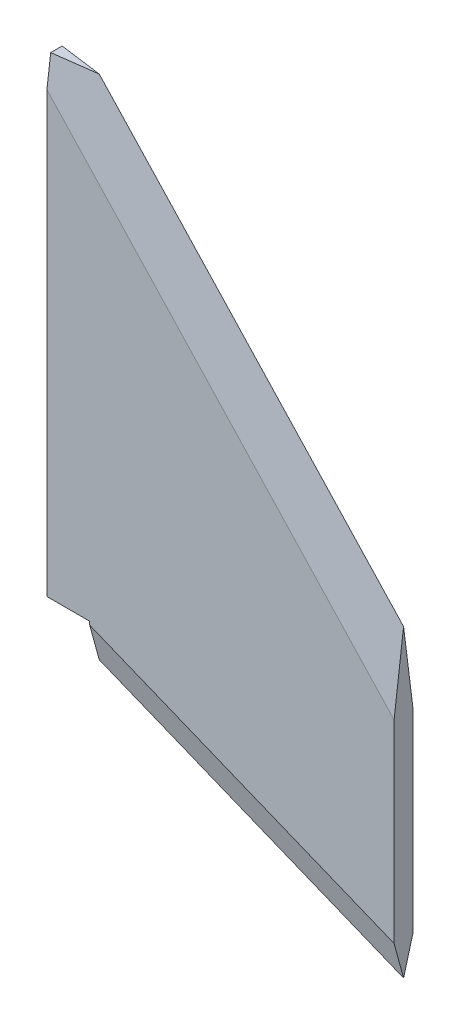
from build123d import *

# Parameters (mm, degrees)
SKETCH2_W                = 10.7188
SKETCH2_H                = 117.475
BOSS_EXTRUDE3_DEPTH      = 4.7498
CUT_EXTRUDE17_DEPTH      = 5.08
CUT_EXTRUDE17_DEPTH_BACK = 101.6
CUT_EXTRUDE18_DEPTH      = 101.6
CUT_EXTRUDE18_DEPTH_BACK = 127


with BuildPart() as part:
    # Sketch2 → Boss-Extrude3 (new body)
    with BuildSketch(Plane.XY):
        Polygon((76.2, -30.9118), (0, 0), (0, 127), (76.2, 45.2882), align=None)
        with Locations((-5.3594, 68.2625)):
            Rectangle(SKETCH2_W, SKETCH2_H)
    extrude(amount=BOSS_EXTRUDE3_DEPTH)

    # Sketch8 → Cut-Extrude17 (cut, two sides: drawn at the far end of the back side and taken through both)
    with BuildSketch(Plane(origin=(0, 0, 0), x_dir=(0, 0, -1), z_dir=(-0.9266549506898317, 0.37591302499650847, 0)).offset(-CUT_EXTRUDE17_DEPTH_BACK)):
        Polygon((-2.3749, 0), (3e-09, -8.038518146), (0.750296228, -8.038518146), (0.750296228, 2.310233708), (-5.314343575, 2.310233708), (-5.314343575, -8.038518146), (-4.749800003, -8.038518146), align=None)
    extrude(amount=CUT_EXTRUDE17_DEPTH + CUT_EXTRUDE17_DEPTH_BACK, mode=Mode.SUBTRACT)

    # Sketch9 → Cut-Extrude18 (cut, two sides: drawn at the far end of the back side and taken through both)
    with BuildSketch(Plane(origin=(12.854537069, -13.784348584, 0), x_dir=(0, 0, -1), z_dir=(0.6820103942193665, -0.731342479401234, 0)).offset(-CUT_EXTRUDE18_DEPTH_BACK)):
        Polygon((-2.3749, 86.615320066), (0, 73.622586943), (0.872559858, 73.622586943), (0.872559858, 91.301528403), (-6.531219552, 91.301528403), (-6.531219552, 73.622586943), (-4.7498, 73.622586943), align=None)
    extrude(amount=CUT_EXTRUDE18_DEPTH + CUT_EXTRUDE18_DEPTH_BACK, mode=Mode.SUBTRACT)


solid = part.part
